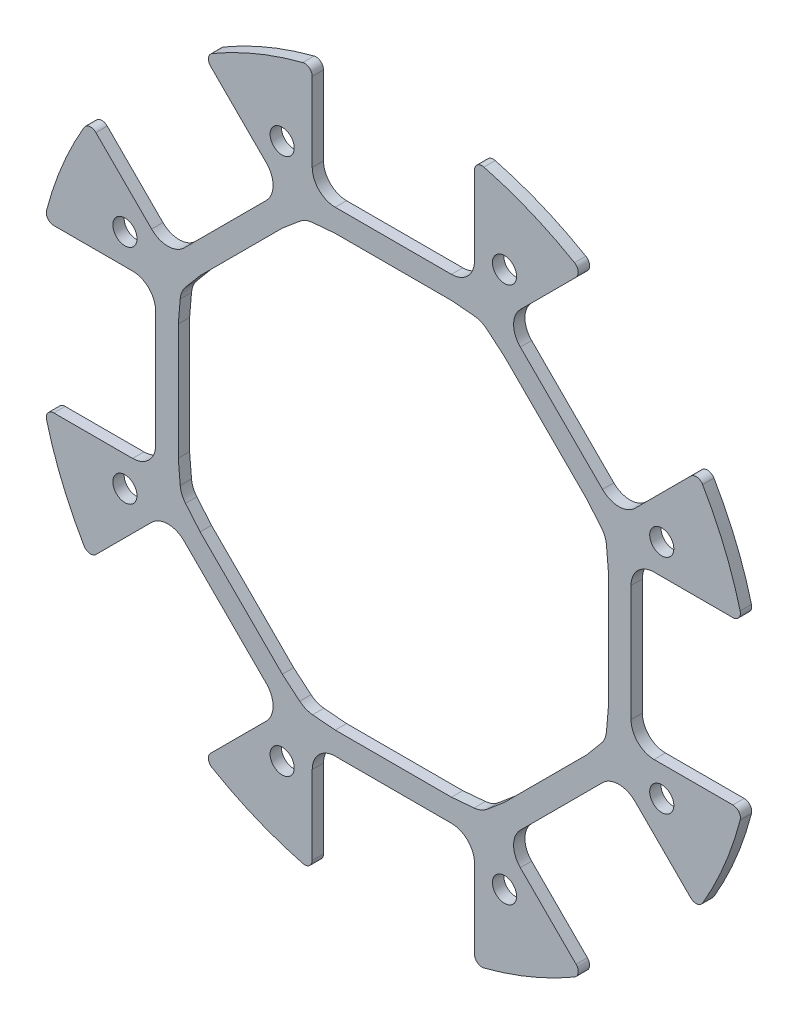
from build123d import *

# Parameters (mm, degrees)
SKETCH_1_R                       = 47.5
EXTRUDE_1_DEPTH                  = 1.5
CUT_EXTRUDE_1_DEPTH              = 68.191889392
CUT_EXTRUDE_2_DEPTH              = 68.191889392
CUT_EXTRUDE_2_DEPTH_BACK         = 68.191889392
SKETCH_3_R                       = 3.1
SKETCH_3_R_2                     = 1.6
SKETCH_4_R                       = 1.6
CUT_EXTRUDE_3_DEPTH              = 68.191889392
CUT_EXTRUDE_4_DEPTH              = 68.191889392
FILLET_1_R                       = 1
FILLET_2_R                       = 0.2
FILLET_3_R                       = 3.05
PATTERN_CIRCULAR_1_COUNT         = 8
FILLET_1_OF_PATTERN_CIRCULAR_1_R = 1
FILLET_2_OF_PATTERN_CIRCULAR_1_R = 0.2
FILLET_3_OF_PATTERN_CIRCULAR_1_R = 3.05
CUT_EXTRUDE_5_DEPTH              = 66.05834985
EXTRUDE_START                    = -1.5
EXTRUDE_2_DEPTH                  = 1.5
FILLET_4_R                       = 3.05
PATTERN_CIRCULAR_2_COUNT         = 8


with BuildPart() as part:
    # ｽｹｯﾁ1 → ﾎﾞｽ - 押し出し1 (new body)
    with BuildSketch(Plane.XY):
        Circle(SKETCH_1_R)
    extrude(amount=EXTRUDE_1_DEPTH)

    # ｽｹｯﾁ2 → ｶｯﾄ - 押し出し1 (cut, through all)
    with BuildSketch(Plane.XY.offset(1.5)):
        Polygon((-10.75, 43.525), (-10.75, 52.5), (10.75, 52.5), (10.75, 43.525), (13, 43.525), (13, 40.475), (10.75, 40.475), (10.75, 31.5), (-10.75, 31.5), (-10.75, 40.475), (-13, 40.475), (-13, 43.525), align=None)
    cut_extrude_1 = extrude(amount=-CUT_EXTRUDE_1_DEPTH, mode=Mode.SUBTRACT)

    # ｽｹｯﾁ3 → ｶｯﾄ - 押し出し2 (cut, two sides: drawn at the far end of the back side and taken through both)
    with BuildSketch(Plane.XY.offset(1.5).offset(-CUT_EXTRUDE_2_DEPTH_BACK)):
        Circle(SKETCH_3_R)
        with Locations((0, 6.5)):
            Circle(SKETCH_3_R_2)
        with Locations((6.5, 0)):
            Circle(SKETCH_3_R_2)
        with Locations((0, -6.5)):
            Circle(SKETCH_3_R_2)
        with Locations((-6.5, 0)):
            Circle(SKETCH_3_R_2)
        with Locations((8.838834765, 8.838834765)):
            Circle(SKETCH_3_R_2)
        with Locations((8.838834765, -8.838834765)):
            Circle(SKETCH_3_R_2)
        with Locations((-8.838834765, -8.838834765)):
            Circle(SKETCH_3_R_2)
        with Locations((-8.838834765, 8.838834765)):
            Circle(SKETCH_3_R_2)
    extrude(amount=CUT_EXTRUDE_2_DEPTH + CUT_EXTRUDE_2_DEPTH_BACK, mode=Mode.SUBTRACT)

    # ｽｹｯﾁ4 → ｶｯﾄ - 押し出し3 (cut, through all)
    with BuildSketch(Plane.XY.offset(1.5)):
        with Locations((14.733312146, 35.569362002)):
            Circle(SKETCH_4_R)
        with Locations((8.610377228, 20.787289482)):
            Circle(SKETCH_4_R)
    cut_extrude_3 = extrude(amount=-CUT_EXTRUDE_3_DEPTH, mode=Mode.SUBTRACT)

    # ｽｹｯﾁ5 → ｶｯﾄ - 押し出し4 (cut, symmetric)
    with BuildSketch(Plane.XY.offset(1.5)):
        Polygon((-7.188286702, 26.5), (7.188286702, 26.5), (3.328075632, 17.180626082), (-3.328075632, 17.180626082), align=None)
    cut_extrude_4 = extrude(amount=CUT_EXTRUDE_4_DEPTH, both=True, mode=Mode.SUBTRACT)

    # ﾌｨﾚｯﾄ1
    fillet_1_edges = [part.edges().sort_by_distance(p)[0] for p in [
        (7.188286702, 26.5, 0.75),
        (3.328075632, 17.180626082, 0.75),
        (-3.328075632, 17.180626082, 0.75),
        (-7.188286702, 26.5, 0.75),
        (10.75, 46.267564232, 0.75),
        (-10.75, 46.267564232, 0.75),
    ]]
    fillet(fillet_1_edges, radius=FILLET_1_R)

    # ﾌｨﾚｯﾄ2
    fillet_2_edges = [part.edges().sort_by_distance(p)[0] for p in [
        (13, 43.525, 0.75),
        (13, 40.475, 0.75),
        (-13, 40.475, 0.75),
        (-13, 43.525, 0.75),
    ]]
    fillet(fillet_2_edges, radius=FILLET_2_R)

    # ﾌｨﾚｯﾄ3
    fillet_3_edges = [part.edges().sort_by_distance(p)[0] for p in [
        (10.75, 31.5, 0.75),
        (-10.75, 31.5, 0.75),
    ]]
    fillet(fillet_3_edges, radius=FILLET_3_R)

    # 円形ﾊﾟﾀｰﾝ1: ｶｯﾄ - 押し出し1, ｶｯﾄ - 押し出し3, ｶｯﾄ - 押し出し4 ×8 about axis
    pattern_circular_1_axis = Axis((0, 0, 0), (0, 0, 1))
    add([cut_extrude_1.rotate(pattern_circular_1_axis, i * 360 / PATTERN_CIRCULAR_1_COUNT) for i in range(1, PATTERN_CIRCULAR_1_COUNT)], mode=Mode.SUBTRACT)
    add([cut_extrude_3.rotate(pattern_circular_1_axis, i * 360 / PATTERN_CIRCULAR_1_COUNT) for i in range(1, PATTERN_CIRCULAR_1_COUNT)], mode=Mode.SUBTRACT)
    add([cut_extrude_4.rotate(pattern_circular_1_axis, i * 360 / PATTERN_CIRCULAR_1_COUNT) for i in range(1, PATTERN_CIRCULAR_1_COUNT)], mode=Mode.SUBTRACT)

    # ﾌｨﾚｯﾄ1 of 円形ﾊﾟﾀｰﾝ1
    fillet_1_of_pattern_circular_1_edges = [part.edges().sort_by_distance(p)[0] for p in [
        (-13.655443429, 23.821215973, 0.75),
        (-9.79523236, 14.501842056, 0.75),
        (-14.501842056, 9.79523236, 0.75),
        (-23.821215973, 13.655443429, 0.75),
        (-25.11471052, 40.317506315, 0.75),
        (-40.317506315, 25.11471052, 0.75),
        (-26.5, 7.188286702, 0.75),
        (-17.180626082, 3.328075632, 0.75),
        (-17.180626082, -3.328075632, 0.75),
        (-26.5, -7.188286702, 0.75),
        (-46.267564232, 10.75, 0.75),
        (-46.267564232, -10.75, 0.75),
        (-23.821215973, -13.655443429, 0.75),
        (-14.501842056, -9.79523236, 0.75),
        (-9.79523236, -14.501842056, 0.75),
        (-13.655443429, -23.821215973, 0.75),
        (-40.317506315, -25.11471052, 0.75),
        (-25.11471052, -40.317506315, 0.75),
        (-7.188286702, -26.5, 0.75),
        (-3.328075632, -17.180626082, 0.75),
        (3.328075632, -17.180626082, 0.75),
        (7.188286702, -26.5, 0.75),
        (-10.75, -46.267564232, 0.75),
        (10.75, -46.267564232, 0.75),
        (13.655443429, -23.821215973, 0.75),
        (9.79523236, -14.501842056, 0.75),
        (14.501842056, -9.79523236, 0.75),
        (23.821215973, -13.655443429, 0.75),
        (25.11471052, -40.317506315, 0.75),
        (40.317506315, -25.11471052, 0.75),
        (26.5, -7.188286702, 0.75),
        (17.180626082, -3.328075632, 0.75),
        (17.180626082, 3.328075632, 0.75),
        (26.5, 7.188286702, 0.75),
        (46.267564232, -10.75, 0.75),
        (46.267564232, 10.75, 0.75),
        (23.821215973, 13.655443429, 0.75),
        (14.501842056, 9.79523236, 0.75),
        (9.79523236, 14.501842056, 0.75),
        (13.655443429, 23.821215973, 0.75),
        (40.317506315, 25.11471052, 0.75),
        (25.11471052, 40.317506315, 0.75),
    ]]
    fillet(fillet_1_of_pattern_circular_1_edges, radius=FILLET_1_OF_PATTERN_CIRCULAR_1_R)

    # ﾌｨﾚｯﾄ2 of 円形ﾊﾟﾀｰﾝ1
    fillet_2_of_pattern_circular_1_edges = [part.edges().sort_by_distance(p)[0] for p in [
        (-21.584434496, 39.969210807, 0.75),
        (-19.427758813, 37.812535124, 0.75),
        (-37.812535124, 19.427758813, 0.75),
        (-39.969210807, 21.584434496, 0.75),
        (-43.525, 13, 0.75),
        (-40.475, 13, 0.75),
        (-40.475, -13, 0.75),
        (-43.525, -13, 0.75),
        (-39.969210807, -21.584434496, 0.75),
        (-37.812535124, -19.427758813, 0.75),
        (-19.427758813, -37.812535124, 0.75),
        (-21.584434496, -39.969210807, 0.75),
        (-13, -43.525, 0.75),
        (-13, -40.475, 0.75),
        (13, -40.475, 0.75),
        (13, -43.525, 0.75),
        (21.584434496, -39.969210807, 0.75),
        (19.427758813, -37.812535124, 0.75),
        (37.812535124, -19.427758813, 0.75),
        (39.969210807, -21.584434496, 0.75),
        (43.525, -13, 0.75),
        (40.475, -13, 0.75),
        (40.475, 13, 0.75),
        (43.525, 13, 0.75),
        (39.969210807, 21.584434496, 0.75),
        (37.812535124, 19.427758813, 0.75),
        (19.427758813, 37.812535124, 0.75),
        (21.584434496, 39.969210807, 0.75),
    ]]
    fillet(fillet_2_of_pattern_circular_1_edges, radius=FILLET_2_OF_PATTERN_CIRCULAR_1_R)

    # ﾌｨﾚｯﾄ3 of 円形ﾊﾟﾀｰﾝ1
    fillet_3_of_pattern_circular_1_edges = [part.edges().sort_by_distance(p)[0] for p in [
        (-14.67246571, 29.875261505, 0.75),
        (-29.875261505, 14.67246571, 0.75),
        (-31.5, 10.75, 0.75),
        (-31.5, -10.75, 0.75),
        (-29.875261505, -14.67246571, 0.75),
        (-14.67246571, -29.875261505, 0.75),
        (-10.75, -31.5, 0.75),
        (10.75, -31.5, 0.75),
        (14.67246571, -29.875261505, 0.75),
        (29.875261505, -14.67246571, 0.75),
        (31.5, -10.75, 0.75),
        (31.5, 10.75, 0.75),
        (29.875261505, 14.67246571, 0.75),
        (14.67246571, 29.875261505, 0.75),
    ]]
    fillet(fillet_3_of_pattern_circular_1_edges, radius=FILLET_3_OF_PATTERN_CIRCULAR_1_R)

    # ｽｹｯﾁ6 → ｶｯﾄ - 押し出し5 (cut, through all)
    with BuildSketch(Plane.XY.offset(1.5)):
        Polygon((11.664524887, 28.160654182), (7.7, 28.5), (-7.7, 28.5), (-11.664524887, 28.160654182), (-14.707821049, 25.597265479), (-25.597265479, 14.707821049), (-28.160654182, 11.664524887), (-28.5, 7.7), (-28.5, -7.7), (-28.160654182, -11.664524887), (-25.597265479, -14.707821049), (-14.707821049, -25.597265479), (-11.664524887, -28.160654182), (-7.7, -28.5), (7.7, -28.5), (11.664524887, -28.160654182), (14.707821049, -25.597265479), (25.597265479, -14.707821049), (28.160654182, -11.664524887), (28.5, -7.7), (28.5, 7.7), (28.160654182, 11.664524887), (25.597265479, 14.707821049), (14.707821049, 25.597265479), align=None)
    extrude(amount=-CUT_EXTRUDE_5_DEPTH, mode=Mode.SUBTRACT)

    # ｽｹｯﾁ7 → ﾎﾞｽ - 押し出し2 (add)
    with BuildSketch(Plane.XY.offset(1.5).offset(EXTRUDE_START)):
        with BuildLine():
            Line((-12.8, 43.525), (-10.75, 43.525))
            Line((-10.75, 43.525), (-10.75, 40.475))
            Line((-10.75, 40.475), (-12.8, 40.475))
            ThreePointArc((-12.8, 40.475), (-12.941421356, 40.533578644), (-13, 40.675))
            Line((-13, 40.675), (-13, 43.325))
            ThreePointArc((-13, 43.325), (-12.941421356, 43.466421356), (-12.8, 43.525))
        make_face()
        with BuildLine():
            Line((12.8, 40.475), (10.75, 40.475))
            Line((10.75, 40.475), (10.75, 43.525))
            Line((10.75, 43.525), (12.8, 43.525))
            ThreePointArc((12.8, 43.525), (12.941421356, 43.466421356), (13, 43.325))
            Line((13, 43.325), (13, 40.675))
            ThreePointArc((13, 40.675), (12.941421356, 40.533578644), (12.8, 40.475))
        make_face()
    extrude_2 = extrude(amount=EXTRUDE_2_DEPTH)

    # ﾌｨﾚｯﾄ4
    fillet_4_edges = [part.edges().sort_by_distance(p)[0] for p in [
        (-11.664524887, 28.160654182, 0.75),
        (11.664524887, 28.160654182, 0.75),
        (28.160654182, 11.664524887, 0.75),
        (28.160654182, -11.664524887, 0.75),
        (11.664524887, -28.160654182, 0.75),
        (-11.664524887, -28.160654182, 0.75),
        (-28.160654182, -11.664524887, 0.75),
        (-28.160654182, 11.664524887, 0.75),
    ]]
    fillet(fillet_4_edges, radius=FILLET_4_R)

    # 円形ﾊﾟﾀｰﾝ2: ﾎﾞｽ - 押し出し2 ×8 about axis
    pattern_circular_2_axis = Axis((0, 0, 0), (0, 0, 1))
    for i in range(1, PATTERN_CIRCULAR_2_COUNT):
        add(extrude_2.rotate(pattern_circular_2_axis, i * 360 / PATTERN_CIRCULAR_2_COUNT))


solid = part.part
